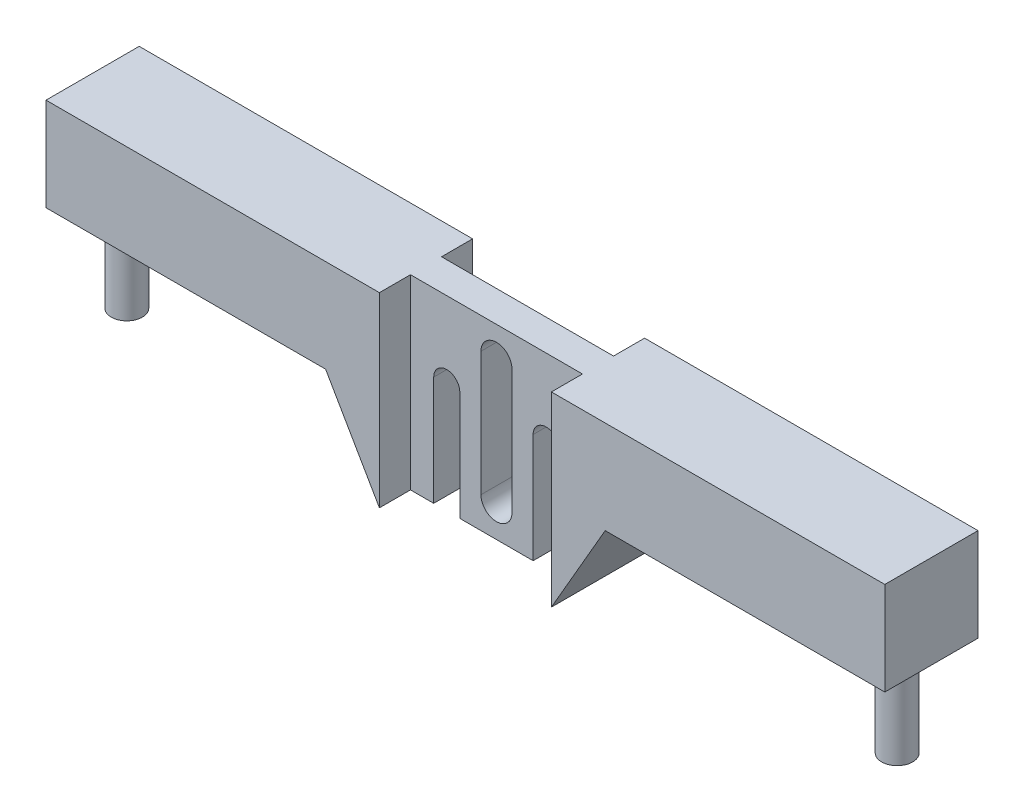
from build123d import *

# Parameters (mm, degrees)
SKETCH1_W           = 135
SKETCH1_H           = 15
BOSS_EXTRUDE1_DEPTH = 7.5
CUT_EXTRUDE1_REACH  = 74.715
CUT_EXTRUDE2_REACH  = 76.246
SKETCH4_W           = 27.679491924
SKETCH4_H           = 5
BOSS_EXTRUDE2_START = -15
SKETCH5_R           = 2.5
BOSS_EXTRUDE2_DEPTH = 15


with BuildPart() as part:
    # Sketch1 → Boss-Extrude1 (new, symmetric)
    with BuildSketch(Plane.XY):
        Rectangle(SKETCH1_W, SKETCH1_H)
        Polygon((22.5, -7.5), (-22.5, -7.5), (-13.839745962, -22.5), (13.839745962, -22.5), align=None)
    extrude(amount=BOSS_EXTRUDE1_DEPTH, both=True)

    # Sketch2 → Cut-Extrude1 (cut, up to next)
    with BuildSketch(Plane.XY.offset(7.5), mode=Mode.PRIVATE) as cut_extrude1_sk1:
        with BuildLine():
            Line((2.5, 2.5), (2.5, -17.5))
            ThreePointArc((2.5, -17.5), (0, -20), (-2.5, -17.5))
            Line((-2.5, -17.5), (-2.5, 2.5))
            ThreePointArc((-2.5, 2.5), (0, 5), (2.5, 2.5))
        make_face()
    cut_extrude1_tool1 = extrude(cut_extrude1_sk1.sketch, amount=-CUT_EXTRUDE1_REACH, mode=Mode.PRIVATE) & part.part
    # Sketch2 → Cut-Extrude1 (cut, up to next)
    with BuildSketch(Plane.XY.offset(7.5), mode=Mode.PRIVATE) as cut_extrude1_sk2:
        with BuildLine():
            Line((10.1, -4.903635329), (10.1, -24.903635329))
            ThreePointArc((10.1, -24.903635329), (8, -27.003635329), (5.9, -24.903635329))
            Line((5.9, -24.903635329), (5.9, -4.903635329))
            ThreePointArc((5.9, -4.903635329), (8, -2.803635329), (10.1, -4.903635329))
        make_face()
    cut_extrude1_tool2 = extrude(cut_extrude1_sk2.sketch, amount=-CUT_EXTRUDE1_REACH, mode=Mode.PRIVATE) & part.part
    # Sketch2 → Cut-Extrude1 (cut, up to next)
    with BuildSketch(Plane.XY.offset(7.5), mode=Mode.PRIVATE) as cut_extrude1_sk3:
        with BuildLine():
            Line((-5.9, -4.903635329), (-5.9, -24.903635329))
            ThreePointArc((-5.9, -24.903635329), (-8, -27.003635329), (-10.1, -24.903635329))
            Line((-10.1, -24.903635329), (-10.1, -4.903635329))
            ThreePointArc((-10.1, -4.903635329), (-8, -2.803635329), (-5.9, -4.903635329))
        make_face()
    cut_extrude1_tool3 = extrude(cut_extrude1_sk3.sketch, amount=-CUT_EXTRUDE1_REACH, mode=Mode.PRIVATE) & part.part
    add(cut_extrude1_tool1.solids().sort_by_distance((0, -7.5, 7.5))[0], mode=Mode.SUBTRACT)
    add(cut_extrude1_tool2.solids().sort_by_distance((8, -14.903635, 7.5))[0], mode=Mode.SUBTRACT)
    add(cut_extrude1_tool3.solids().sort_by_distance((-8, -14.903635, 7.5))[0], mode=Mode.SUBTRACT)

    # Sketch4 → Cut-Extrude2 (cut, up to next)
    with BuildSketch(Plane.XZ.offset(22.5), mode=Mode.PRIVATE) as cut_extrude2_sk1:
        with Locations((0, 5)):
            Rectangle(SKETCH4_W, SKETCH4_H)
    cut_extrude2_tool1 = extrude(cut_extrude2_sk1.sketch, amount=-CUT_EXTRUDE2_REACH, mode=Mode.PRIVATE) & part.part
    # Sketch4 → Cut-Extrude2 (cut, up to next)
    with BuildSketch(Plane.XZ.offset(22.5), mode=Mode.PRIVATE) as cut_extrude2_sk2:
        with Locations((0, -5)):
            Rectangle(SKETCH4_W, SKETCH4_H)
    cut_extrude2_tool2 = extrude(cut_extrude2_sk2.sketch, amount=-CUT_EXTRUDE2_REACH, mode=Mode.PRIVATE) & part.part
    add(cut_extrude2_tool1.solids().sort_by_distance((0, -22.5, 5))[0], mode=Mode.SUBTRACT)
    add(cut_extrude2_tool2.solids().sort_by_distance((0, -22.5, -5))[0], mode=Mode.SUBTRACT)

    # Sketch5 → Boss-Extrude2 (add)
    with BuildSketch(Plane(origin=(0, 7.5, 0), x_dir=(1, 0, 0), z_dir=(0, 1, 0)).offset(BOSS_EXTRUDE2_START)):
        with Locations(Location((61.994193156, 0, 0), (0, 0, 270))):
            Circle(SKETCH5_R)
        with Locations(Location((-61.994193156, 0, 0), (0, 0, 270))):
            Circle(SKETCH5_R)
    extrude(amount=-BOSS_EXTRUDE2_DEPTH)


solid = part.part
